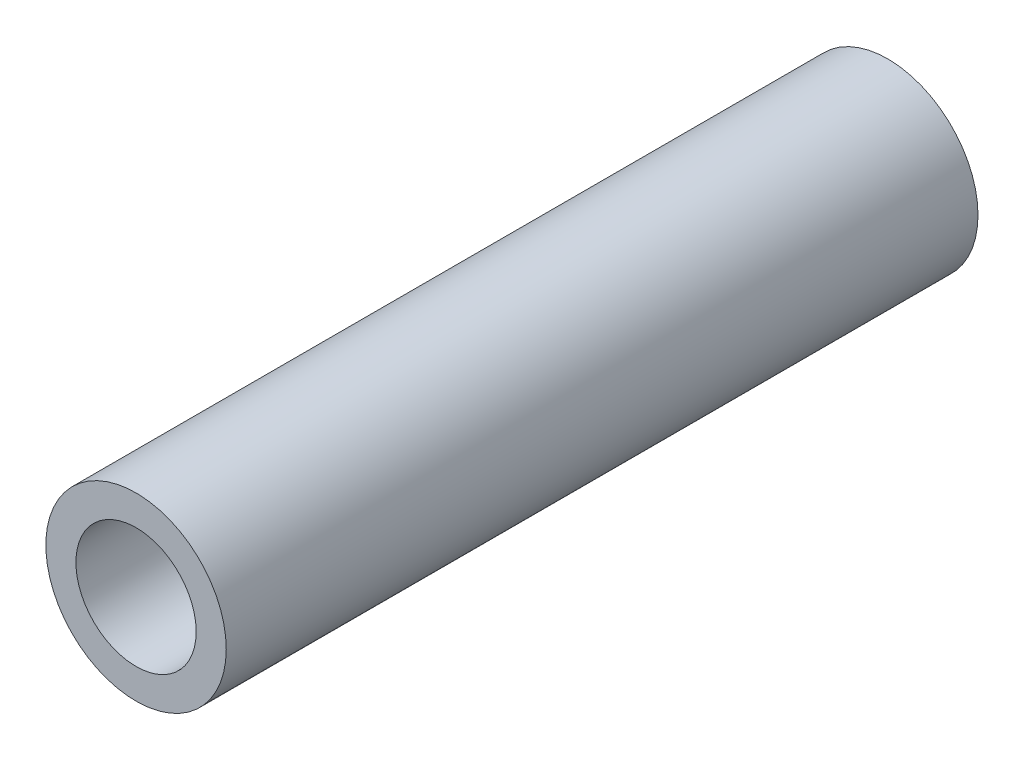
from build123d import *

# Parameters (mm, degrees)
SKETCH_1_R      = 3
SKETCH_1_R_2    = 2
EXTRUDE_1_DEPTH = 12.5


with BuildPart() as part:
    # 草图1 → 凸台-拉伸1 (new, symmetric)
    with BuildSketch(Plane.XY):
        Circle(SKETCH_1_R)
        Circle(SKETCH_1_R_2, mode=Mode.SUBTRACT)
    extrude(amount=EXTRUDE_1_DEPTH, both=True)


solid = part.part
